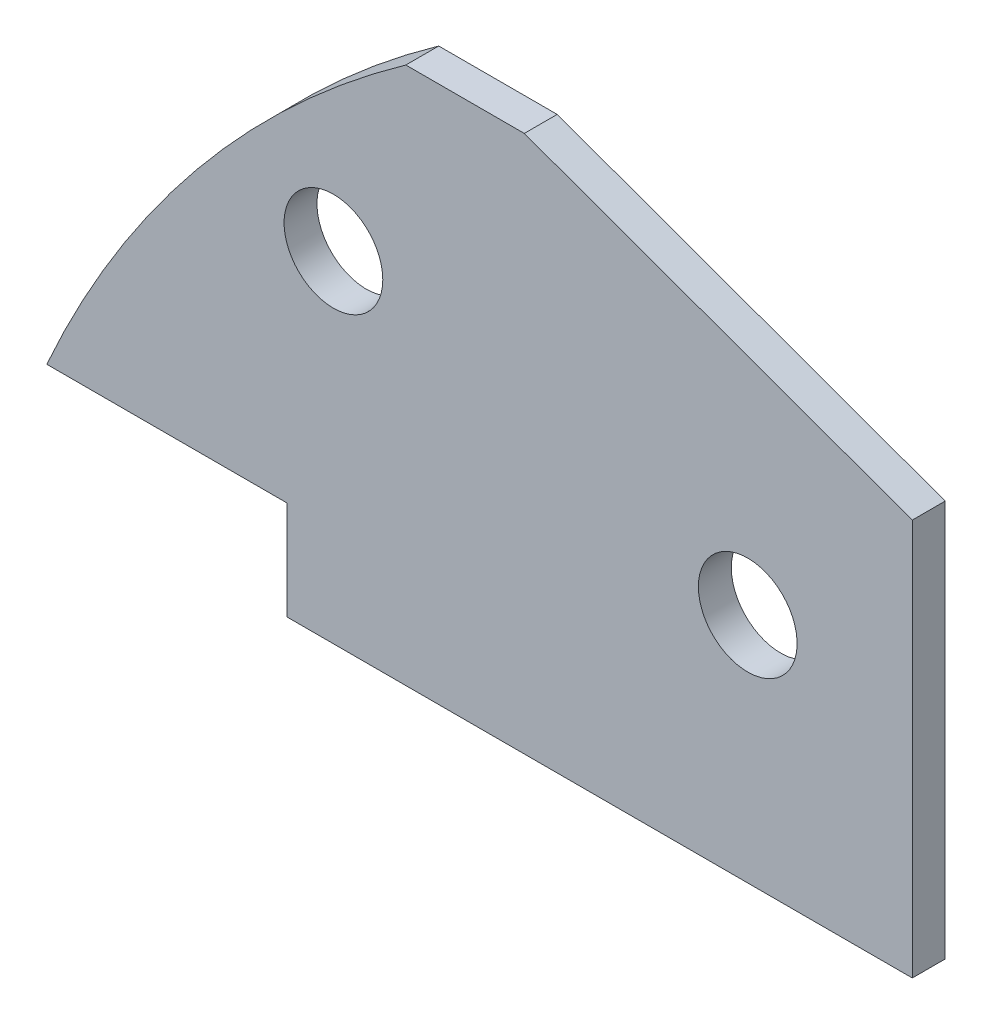
from build123d import *

# Parameters (mm, degrees)
BOSS_EXTRUDE1_DEPTH = 3
SKETCH2_R           = 1.5
CUT_EXTRUDE3_DEPTH  = 3
CUT_EXTRUDE4_START  = -10
CUT_EXTRUDE4_DEPTH  = 10
BOSS_EXTRUDE2_START = -3
BOSS_EXTRUDE2_DEPTH = 3
SKETCH5_W           = 0.56
SKETCH5_H           = 32.898596714
CUT_EXTRUDE5_DEPTH  = 3
SKETCH6_W           = 0.2
SKETCH6_H           = 32.898596714
CUT_EXTRUDE6_DEPTH  = 3
SKETCH7_R           = 2
CUT_EXTRUDE8_DEPTH  = 3
BOSS_EXTRUDE3_START = -3
BOSS_EXTRUDE3_DEPTH = 3
CUT_EXTRUDE9_START  = -3
CUT_EXTRUDE9_DEPTH  = 3
BOSS_EXTRUDE5_START = -3
BOSS_EXTRUDE5_DEPTH = 3
CUT_EXTRUDE10_START = -2
CUT_EXTRUDE10_DEPTH = 2
CUT_EXTRUDE11_START = -3
CUT_EXTRUDE11_DEPTH = 3
SKETCH13_R          = 1.5
CUT_EXTRUDE12_DEPTH = 1
CUT_EXTRUDE13_DEPTH = 1
SKETCH16_R          = 1.5
CUT_EXTRUDE16_DEPTH = 10


with BuildPart() as part:
    # Sketch1 → Boss-Extrude1 (new body)
    with BuildSketch(Plane.XY):
        with BuildLine():
            Line((-11, 25.5), (-22.790038711, 29.780264196))
            ThreePointArc((-22.790038711, 29.780264196), (0, -37.5), (22.790038711, 29.780264196))
            Line((22.790038711, 29.780264196), (11, 25.5))
            Line((11, 25.5), (-11, 25.5))
        make_face()
    extrude(amount=BOSS_EXTRUDE1_DEPTH)

    # Sketch2 → Cut-Extrude3 (cut)
    with BuildSketch(Plane.XY.offset(3)):
        with Locations((-25.400000001, 10.496905453)):
            Circle(SKETCH2_R)
        with Locations((-25.399981845, -10.493094547)):
            Circle(SKETCH2_R)
        with Locations(Location((25.399981845, -10.493094547, 0), (0, 0, 180))):
            Circle(SKETCH2_R)
        with Locations(Location((25.400000001, 10.496905453, 0), (0, 0, 180))):
            Circle(SKETCH2_R)
    extrude(amount=-CUT_EXTRUDE3_DEPTH, mode=Mode.SUBTRACT)

    # Sketch3 → Cut-Extrude4 (cut)
    with BuildSketch(Plane.XY.offset(3).offset(CUT_EXTRUDE4_START)):
        with BuildLine():
            Line((-30.76, 21.449298357), (-30.76, -21.449298357))
            ThreePointArc((-30.76, -21.449298357), (-37.5, 0), (-30.76, 21.449298357))
        make_face()
        with BuildLine():
            Line((30.76, 21.449298357), (30.76, -21.449298357))
            ThreePointArc((30.76, -21.449298357), (37.5, 0), (30.76, 21.449298357))
        make_face()
    extrude(amount=CUT_EXTRUDE4_DEPTH, mode=Mode.SUBTRACT)

    # Sketch4 → Boss-Extrude2 (add)
    with BuildSketch(Plane.XY.offset(3).offset(BOSS_EXTRUDE2_START)):
        with BuildLine():
            Line((-30.76, -21.449298357), (-30.76, -16.449298357))
            Line((-30.76, -16.449298357), (-33.699711921, -16.449298357))
            ThreePointArc((-33.699711921, -16.449298357), (-32.32667034, -19.006219634), (-30.76, -21.449298357))
        make_face()
        with BuildLine():
            Line((-33.699711921, 16.449298357), (-30.76, 16.449298357))
            Line((-30.76, 16.449298357), (-30.76, 21.449298357))
            ThreePointArc((-30.76, 21.449298357), (-32.32667034, 19.006219634), (-33.699711921, 16.449298357))
        make_face()
        with BuildLine():
            Line((30.76, 21.449298357), (30.76, 16.449298357))
            Line((30.76, 16.449298357), (33.699711921, 16.449298357))
            ThreePointArc((33.699711921, 16.449298357), (32.32667034, 19.006219634), (30.76, 21.449298357))
        make_face()
        with BuildLine():
            Line((30.76, -16.449298357), (30.76, -21.449298357))
            ThreePointArc((30.76, -21.449298357), (32.32667034, -19.006219634), (33.699711921, -16.449298357))
            Line((33.699711921, -16.449298357), (30.76, -16.449298357))
        make_face()
    extrude(amount=BOSS_EXTRUDE2_DEPTH)

    # Sketch5 → Cut-Extrude5 (cut)
    with BuildSketch(Plane.XY.offset(3)):
        with Locations((-30.48, 0)):
            Rectangle(SKETCH5_W, SKETCH5_H)
        with Locations((30.48, 0)):
            Rectangle(SKETCH5_W, SKETCH5_H)
    extrude(amount=-CUT_EXTRUDE5_DEPTH, mode=Mode.SUBTRACT)

    # Sketch6 → Cut-Extrude6 (cut)
    with BuildSketch(Plane.XY.offset(3)):
        with Locations((-30.1, 0)):
            Rectangle(SKETCH6_W, SKETCH6_H)
        with Locations((30.1, 0)):
            Rectangle(SKETCH6_W, SKETCH6_H)
    extrude(amount=-CUT_EXTRUDE6_DEPTH, mode=Mode.SUBTRACT)

    # Sketch7 → Cut-Extrude8 (cut)
    with BuildSketch(Plane.XY.offset(3)):
        with Locations((-19.15, -21.55)):
            Circle(SKETCH7_R)
        with Locations(Location((19.15, -21.55, 0), (0, 0, 180))):
            Circle(SKETCH7_R)
    extrude(amount=-CUT_EXTRUDE8_DEPTH, mode=Mode.SUBTRACT)

    # Sketch8 → Boss-Extrude3 (add)
    with BuildSketch(Plane.XY.offset(3).offset(BOSS_EXTRUDE3_START)):
        with BuildLine():
            Line((-33.699711921, 16.449298357), (-37.299711921, 16.449298357))
            ThreePointArc((-37.299711921, 16.449298357), (-32.744884003, 23.851322108), (-26.390038711, 29.780264196))
            Line((-26.390038711, 29.780264196), (-22.790038711, 29.780264196))
            ThreePointArc((-22.790038711, 29.780264196), (-29.020710607, 23.749702226), (-33.699711921, 16.449298357))
        make_face()
        with BuildLine():
            Line((33.699711921, 16.449298357), (37.299711921, 16.449298357))
            ThreePointArc((37.299711921, 16.449298357), (32.744884003, 23.851322108), (26.390038711, 29.780264196))
            Line((26.390038711, 29.780264196), (22.790038711, 29.780264196))
            ThreePointArc((22.790038711, 29.780264196), (29.020710607, 23.749702226), (33.699711921, 16.449298357))
        make_face()
    extrude(amount=BOSS_EXTRUDE3_DEPTH)

    # Sketch9 → Cut-Extrude9 (cut)
    with BuildSketch(Plane.XY.offset(3).offset(CUT_EXTRUDE9_START)):
        with BuildLine():
            Line((4.733920151, -37.2), (-4.733920151, -37.2))
            ThreePointArc((-4.733920151, -37.2), (0, -37.5), (4.733920151, -37.2))
        make_face()
    extrude(amount=CUT_EXTRUDE9_DEPTH, mode=Mode.SUBTRACT)

    # Sketch10 → Boss-Extrude5 (add)
    with BuildSketch(Plane.XY.offset(3).offset(BOSS_EXTRUDE5_START)):
        with BuildLine():
            ThreePointArc((-4.733920151, -37.2), (-21.838816892, -30.484685938), (-33.699711921, -16.449298357))
            Line((-33.699711921, -16.449298357), (-37.299711921, -16.449298357))
            ThreePointArc((-37.299711921, -16.449298357), (-23.43831182, -30.624902723), (-4.733920151, -37.2))
        make_face()
        with BuildLine():
            ThreePointArc((33.699711921, -16.449298357), (21.838816892, -30.484685938), (4.733920151, -37.2))
            ThreePointArc((4.733920151, -37.2), (23.43831182, -30.624902723), (37.299711921, -16.449298357))
            Line((37.299711921, -16.449298357), (33.699711921, -16.449298357))
        make_face()
        with BuildLine():
            Line((4.733920151, -37.2), (-4.733920151, -37.2))
            ThreePointArc((-4.733920151, -37.2), (0, -37.457659609), (4.733920151, -37.2))
        make_face()
    extrude(amount=BOSS_EXTRUDE5_DEPTH)

    # Sketch11 → Cut-Extrude10 (cut)
    with BuildSketch(Plane.XY.offset(3).offset(CUT_EXTRUDE10_START)):
        with BuildLine():
            Line((-30, 16.449298357), (-30, 13.449298357))
            Line((-30, 13.449298357), (30, 13.449298357))
            Line((30, 13.449298357), (30, 16.449298357))
            Line((30, 16.449298357), (37.299711921, 16.449298357))
            ThreePointArc((37.299711921, 16.449298357), (32.744884003, 23.851322108), (26.390038711, 29.780264196))
            Line((26.390038711, 29.780264196), (22.790038711, 29.780264196))
            Line((22.790038711, 29.780264196), (11, 25.5))
            Line((11, 25.5), (-11, 25.5))
            Line((-11, 25.5), (-22.790038711, 29.780264196))
            Line((-22.790038711, 29.780264196), (-26.390038711, 29.780264196))
            ThreePointArc((-26.390038711, 29.780264196), (-32.744884003, 23.851322108), (-37.299711921, 16.449298357))
            Line((-37.299711921, 16.449298357), (-30, 16.449298357))
        make_face()
    extrude(amount=CUT_EXTRUDE10_DEPTH, mode=Mode.SUBTRACT)

    # Sketch12 → Cut-Extrude11 (cut)
    with BuildSketch(Plane.XY.offset(3).offset(CUT_EXTRUDE11_START)):
        with BuildLine():
            Line((-30, 13.449298357), (-30, -16.449298357))
            Line((-30, -16.449298357), (-37.299711921, -16.449298357))
            ThreePointArc((-37.299711921, -16.449298357), (0, -37.457659609), (37.299711921, -16.449298357))
            Line((37.299711921, -16.449298357), (30, -16.449298357))
            Line((30, -16.449298357), (30, 13.449298357))
            Line((30, 13.449298357), (-30, 13.449298357))
        make_face()
    extrude(amount=CUT_EXTRUDE11_DEPTH, mode=Mode.SUBTRACT)

    # Sketch13 → Cut-Extrude12 (cut)
    with BuildSketch(Plane.XY.offset(1)):
        with Locations((-28.590038711, 23.780264196)):
            Circle(SKETCH13_R)
        with Locations(Location((28.590038711, 23.780264196, 0), (0, 0, 180))):
            Circle(SKETCH13_R)
    extrude(amount=-CUT_EXTRUDE12_DEPTH, mode=Mode.SUBTRACT)

    # Sketch14 → Cut-Extrude13 (cut)
    with BuildSketch(Plane(origin=(0, 0, 0), x_dir=(-1, 0, 0), z_dir=(0, 0, -1))):
        Polygon((11, 25.5), (11, 13.449298357), (-37.921130539, 13.449298357), (-37.921130539, 32.14037145), (-13.46056527, 32.14037145), (-11, 25.5), align=None)
    extrude(amount=-CUT_EXTRUDE13_DEPTH, mode=Mode.SUBTRACT)

    # Sketch16 → Cut-Extrude16 (cut)
    with BuildSketch(Plane(origin=(0, 0, 0), x_dir=(-1, 0, 0), z_dir=(0, 0, -1))):
        with Locations((16, 20.5)):
            Circle(SKETCH16_R)
    extrude(amount=-CUT_EXTRUDE16_DEPTH, mode=Mode.SUBTRACT)


solid = part.part
